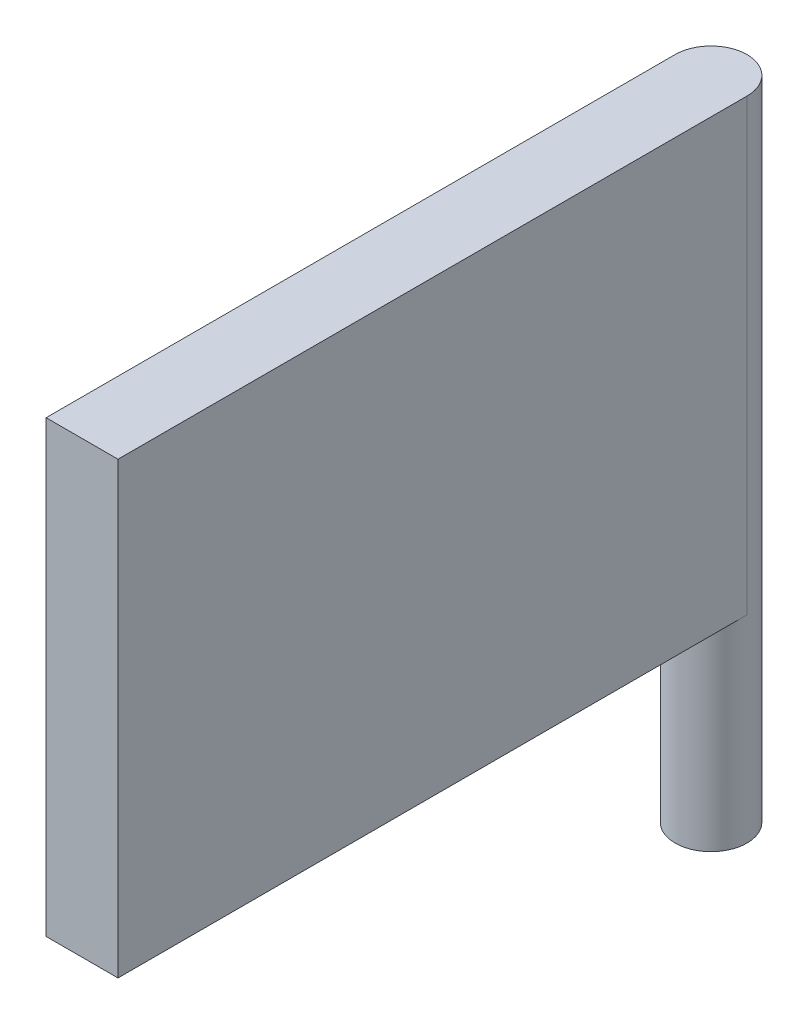
from build123d import *

# Parameters (mm, degrees)
SKETCH1_R           = 4
BOSS_EXTRUDE1_DEPTH = 72
SKETCH2_W           = 8
SKETCH2_H           = 50
BOSS_EXTRUDE2_DEPTH = 70


with BuildPart() as part:
    # Sketch1 → Boss-Extrude1 (new body)
    with BuildSketch(Plane(origin=(0, 0, 0), x_dir=(1, 0, 0), z_dir=(0, 1, 0))):
        with Locations(Location((0, 0, 0), (0, 0, 270))):
            Circle(SKETCH1_R)
    extrude(amount=BOSS_EXTRUDE1_DEPTH)

    # Sketch2 → Boss-Extrude2 (add)
    with BuildSketch(Plane.XY):
        with Locations((0, 47)):
            Rectangle(SKETCH2_W, SKETCH2_H)
    extrude(amount=BOSS_EXTRUDE2_DEPTH)


solid = part.part
